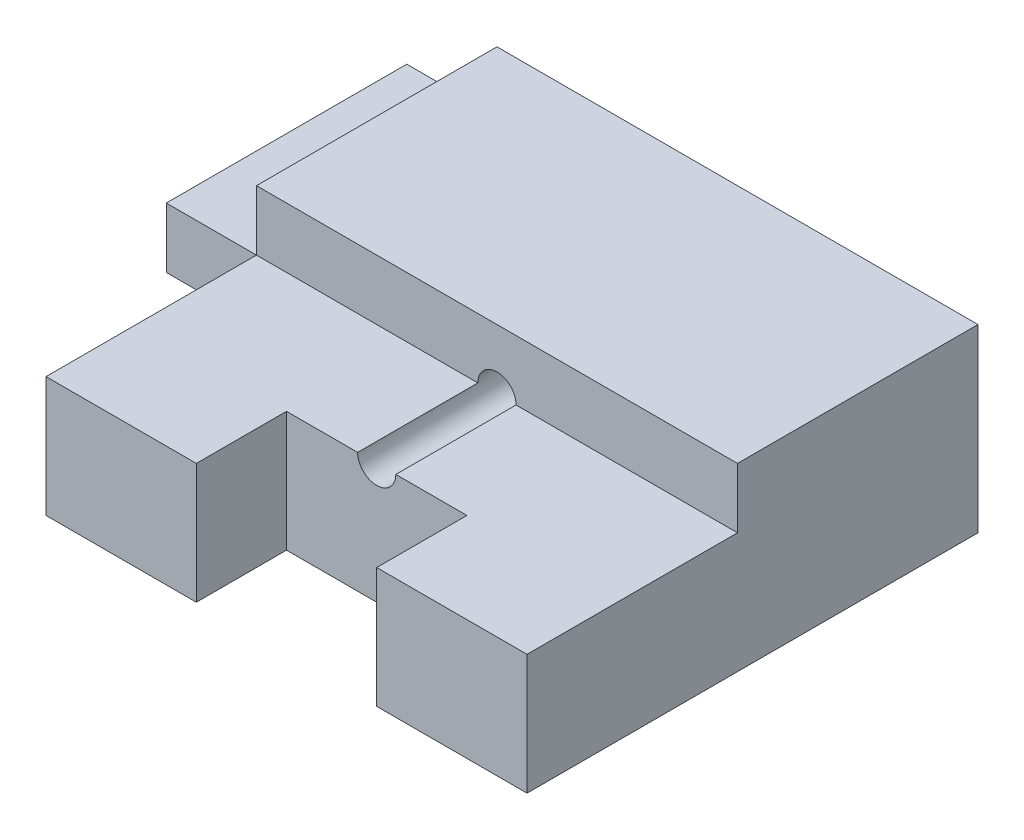
from build123d import *

# Parameters (mm, degrees)
SKETCH2_W           = 15.9999934
SKETCH2_H           = 15
BOSS_EXTRUDE2_DEPTH = 6
SKETCH6_W           = 16
SKETCH6_H           = 7
CUT_EXTRUDE3_DEPTH  = 2
SKETCH7_W           = 6
SKETCH7_H           = 3
CUT_EXTRUDE4_DEPTH  = 23.293492073
SKETCH12_R          = 0.635
CUT_EXTRUDE5_DEPTH  = 100
SKETCH13_W          = 8
SKETCH13_H          = 2
BOSS_EXTRUDE3_DEPTH = 3


with BuildPart() as part:
    # Sketch2 → Boss-Extrude2 (new body)
    with BuildSketch(Plane(origin=(0, 0, 0), x_dir=(1, 0, 0), z_dir=(0, 1, 0))):
        with Locations((-7.9999967, 7.5)):
            Rectangle(SKETCH2_W, SKETCH2_H)
    extrude(amount=BOSS_EXTRUDE2_DEPTH)

    # Sketch6 → Cut-Extrude3 (cut)
    with BuildSketch(Plane(origin=(0, 6, 0), x_dir=(1, 0, 0), z_dir=(0, 1, 0))):
        with Locations((-7.9999934, 3.5)):
            Rectangle(SKETCH6_W, SKETCH6_H)
    extrude(amount=-CUT_EXTRUDE3_DEPTH, mode=Mode.SUBTRACT)

    # Sketch7 → Cut-Extrude4 (cut, through all)
    with BuildSketch(Plane(origin=(0, 4, 0), x_dir=(1, 0, 0), z_dir=(0, 1, 0))):
        with Locations((-8, 1.5)):
            Rectangle(SKETCH7_W, SKETCH7_H)
    extrude(amount=-CUT_EXTRUDE4_DEPTH, mode=Mode.SUBTRACT)

    # Sketch12 → Cut-Extrude5 (cut)
    with BuildSketch(Plane(origin=(0, 0, -15), x_dir=(-1, 0, 0), z_dir=(0, 0, -1))):
        with Locations((7.9999967, 4)):
            Circle(SKETCH12_R)
    extrude(amount=-CUT_EXTRUDE5_DEPTH, mode=Mode.SUBTRACT)

    # Sketch13 → Boss-Extrude3 (add)
    with BuildSketch(Plane.ZY.offset(15.9999934)):
        with Locations((-11, 3)):
            Rectangle(SKETCH13_W, SKETCH13_H)
    extrude(amount=BOSS_EXTRUDE3_DEPTH)


solid = part.part
